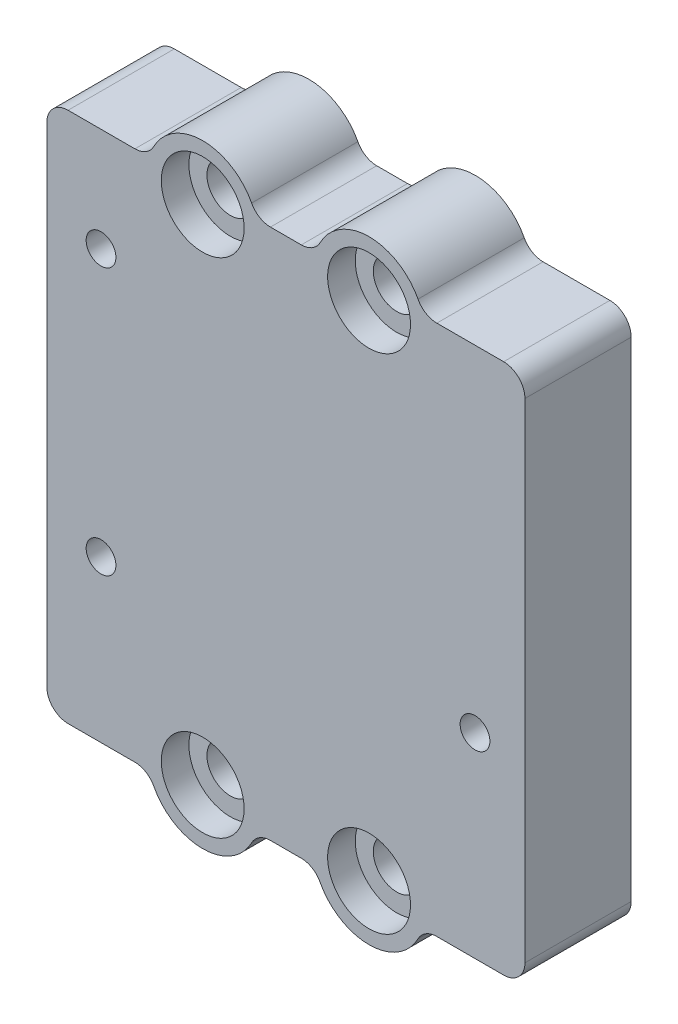
from build123d import *

# Parameters (mm, degrees)
SKETCH1_R           = 2.794
BOSS_EXTRUDE1_DEPTH = 12.7
SKETCH2_R           = 1.778
CUT_EXTRUDE1_DEPTH  = 49.178879085
SKETCH4_R           = 4.953
CUT_EXTRUDE3_DEPTH  = 3.302
FILLET1_R           = 2.54
CUT_EXTRUDE4_DEPTH  = 3.302


with BuildPart() as part:
    # Sketch1 → Boss-Extrude1 (new body)
    with BuildSketch(Plane.XY):
        with BuildLine():
            ThreePointArc((28.575, 29.21), (27.831051224, 31.006051224), (26.035, 31.75))
            Line((26.035, 31.75), (16.32506331, 31.75))
            ThreePointArc((16.32506331, 31.75), (9.9441, 36.6522), (3.56313669, 31.75))
            Line((3.56313669, 31.75), (-3.56313669, 31.75))
            ThreePointArc((-3.56313669, 31.75), (-9.9441, 36.6522), (-16.32506331, 31.75))
            Line((-16.32506331, 31.75), (-26.035, 31.75))
            ThreePointArc((-26.035, 31.75), (-27.831051224, 31.006051224), (-28.575, 29.21))
            Line((-28.575, 29.21), (-28.575, -29.21))
            ThreePointArc((-28.575, -29.21), (-27.831051224, -31.006051224), (-26.035, -31.75))
            Line((-26.035, -31.75), (-16.32506331, -31.75))
            ThreePointArc((-16.32506331, -31.75), (-9.9441, -36.6522), (-3.56313669, -31.75))
            Line((-3.56313669, -31.75), (3.56313669, -31.75))
            ThreePointArc((3.56313669, -31.75), (9.9441, -36.6522), (16.32506331, -31.75))
            Line((16.32506331, -31.75), (26.035, -31.75))
            ThreePointArc((26.035, -31.75), (27.831051224, -31.006051224), (28.575, -29.21))
            Line((28.575, -29.21), (28.575, 29.21))
        make_face()
        with Locations((-9.9441, 30.0482)):
            Circle(SKETCH1_R, mode=Mode.SUBTRACT)
        with Locations((9.9441, 30.0482)):
            Circle(SKETCH1_R, mode=Mode.SUBTRACT)
        with Locations((9.9441, -30.0482)):
            Circle(SKETCH1_R, mode=Mode.SUBTRACT)
        with Locations((-9.9441, -30.0482)):
            Circle(SKETCH1_R, mode=Mode.SUBTRACT)
    extrude(amount=BOSS_EXTRUDE1_DEPTH)

    # Sketch2 → Cut-Extrude1 (cut, through all)
    with BuildSketch(Plane.XY.offset(12.7)):
        with Locations((-22.098, 19.3675)):
            Circle(SKETCH2_R)
        with Locations((-22.098, -12.5095)):
            Circle(SKETCH2_R)
        with Locations((22.606, -8.3693)):
            Circle(SKETCH2_R)
    extrude(amount=-CUT_EXTRUDE1_DEPTH, mode=Mode.SUBTRACT)

    # Sketch4 → Cut-Extrude3 (cut)
    with BuildSketch(Plane.XY.offset(12.7)):
        with Locations((-9.9441, 30.0482)):
            Circle(SKETCH4_R)
        with Locations((9.9441, 30.0482)):
            Circle(SKETCH4_R)
        with Locations((-9.9441, -30.0482)):
            Circle(SKETCH4_R)
        with Locations((9.9441, -30.0482)):
            Circle(SKETCH4_R)
    extrude(amount=-CUT_EXTRUDE3_DEPTH, mode=Mode.SUBTRACT)

    # Fillet1
    fillet1_edges = [part.edges().sort_by_distance(p)[0] for p in [
        (16.32506331, 31.75, 6.35),
        (16.32506331, -31.75, 6.35),
        (3.56313669, -31.75, 6.35),
        (-3.56313669, -31.75, 6.35),
        (-16.32506331, -31.75, 6.35),
        (-16.32506331, 31.75, 6.35),
        (-3.56313669, 31.75, 6.35),
        (3.56313669, 31.75, 6.35),
    ]]
    fillet(fillet1_edges, radius=FILLET1_R)

    # Sketch3 → Cut-Extrude4 (cut)
    with BuildSketch(Plane(origin=(0, 0, 0), x_dir=(-1, 0, 0), z_dir=(0, 0, -1))):
        Polygon((-22.606, -12.475415114), (-19.05, -10.422357557), (-19.05, -6.316242443), (-22.606, -4.263184886), (-26.162, -6.316242443), (-26.162, -10.422357557), align=None)
        Polygon((22.098, -16.615615114), (25.654, -14.562557557), (25.654, -10.456442443), (22.098, -8.403384886), (18.542, -10.456442443), (18.542, -14.562557557), align=None)
        Polygon((22.098, 15.261384886), (25.654, 17.314442443), (25.654, 21.420557557), (22.098, 23.473615114), (18.542, 21.420557557), (18.542, 17.314442443), align=None)
    extrude(amount=-CUT_EXTRUDE4_DEPTH, mode=Mode.SUBTRACT)


solid = part.part
